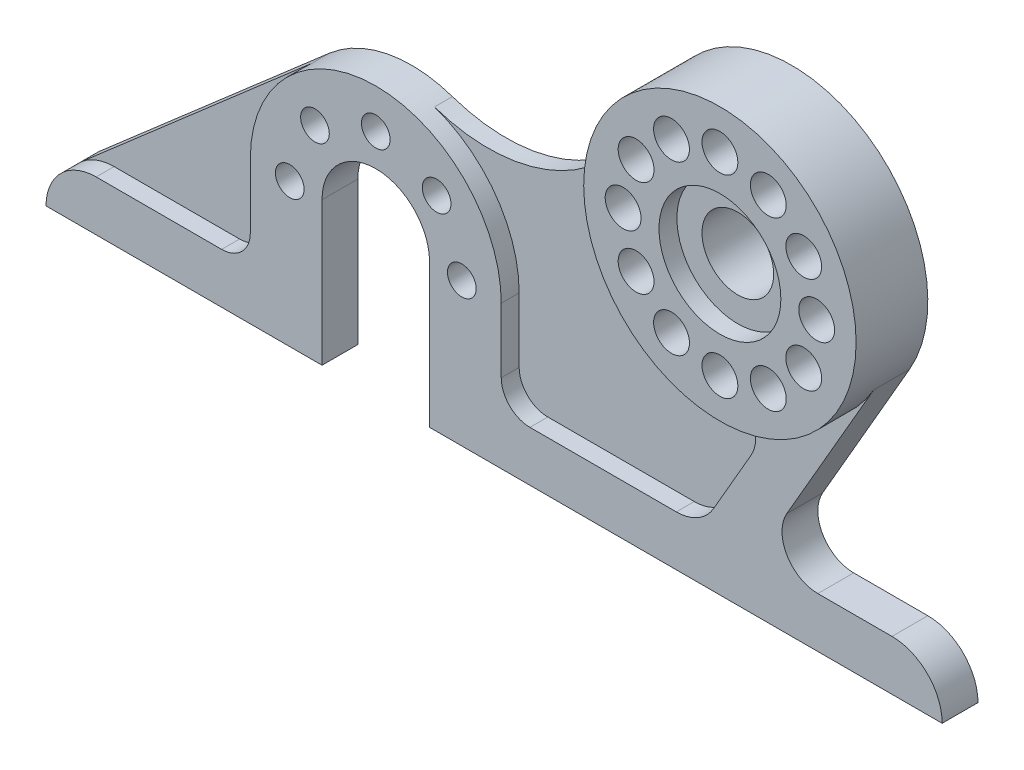
from build123d import *

# Parameters (mm, degrees)
SKETCH_1_R      = 4
EXTRUDE_1_DEPTH = 10
EXTRUDE_2_DEPTH = 5
SKETCH_1_4_R    = 17
SKETCH_1_4_R_2  = 10
EXTRUDE_3_DEPTH = 15
SKETCH_1_5_R    = 38
SKETCH_1_5_R_2  = 5
SKETCH_1_5_R_3  = 17
EXTRUDE_4_DEPTH = 20


with BuildPart() as part:
    # Эскиз1 → Бобышка-Вытянуть1 (new body)
    with BuildSketch(Plane.XY):
        with BuildLine():
            Line((-198, -90), (-121, -90))
            Line((-121, -90), (-121, -50))
            ThreePointArc((-121, -50), (-106, -35), (-91, -50))
            Line((-91, -50), (-91, -90))
            Line((-91, -90), (52, -90))
            ThreePointArc((52, -90), (47.899494937, -80.100505063), (38, -76))
            Line((38, -76), (17.320508076, -76))
            ThreePointArc((17.320508076, -76), (8.660254038, -71), (8.660254038, -61))
            Line((8.660254038, -61), (32.908965344, -19))
            ThreePointArc((32.908965344, -19), (15.44850963, -34.718057984), (-7.916666667, -37.166199549))
            ThreePointArc((-7.916666667, -37.166199549), (-0.863668952, -42.881381106), (-1.339745962, -51.946778377))
            Line((-1.339745962, -51.946778377), (-11.762778326, -70))
            ThreePointArc((-11.762778326, -70), (-16.155083171, -74.392304845), (-22.155083171, -76))
            Line((-22.155083171, -76), (-63, -76))
            ThreePointArc((-63, -76), (-68.656854249, -73.656854249), (-71, -68))
            Line((-71, -68), (-71, -50))
            ThreePointArc((-71, -50), (-106, -15), (-141, -50))
            Line((-141, -50), (-141, -68))
            ThreePointArc((-141, -68), (-143.343145751, -73.656854249), (-149, -76))
            Line((-149, -76), (-184, -76))
            ThreePointArc((-184, -76), (-193.899494937, -80.100505063), (-198, -90))
        make_face()
        with Locations((-130, -50)):
            Circle(SKETCH_1_R, mode=Mode.SUBTRACT)
        with Locations((-82, -50)):
            Circle(SKETCH_1_R, mode=Mode.SUBTRACT)
        with Locations((-122.970562748, -33.029437252)):
            Circle(SKETCH_1_R, mode=Mode.SUBTRACT)
        with Locations((-89.029437252, -33.029437252)):
            Circle(SKETCH_1_R, mode=Mode.SUBTRACT)
        with Locations((-106, -26)):
            Circle(SKETCH_1_R, mode=Mode.SUBTRACT)
    extrude(amount=EXTRUDE_1_DEPTH)

    # Эскиз1<3> → Бобышка-Вытянуть2 (add)
    with BuildSketch(Plane.XY):
        with BuildLine():
            Line((-128.966962921, -23.589422305), (-193.186785168, -79.435768922))
            ThreePointArc((-193.186785168, -79.435768922), (-188.904118927, -76.887043905), (-184, -76))
            Line((-184, -76), (-149, -76))
            ThreePointArc((-149, -76), (-143.343145751, -73.656854249), (-141, -68))
            Line((-141, -68), (-141, -50))
            ThreePointArc((-141, -50), (-137.849989813, -35.488688933), (-128.966962921, -23.589422305))
        make_face()
        with BuildLine():
            ThreePointArc((-36.043919772, 12.034776584), (-59.305035094, -14.640262917), (-94.625446436, -16.899856024))
            ThreePointArc((-94.625446436, -16.899856024), (-77.512201079, -29.666645318), (-71, -50))
            Line((-71, -50), (-71, -68))
            ThreePointArc((-71, -68), (-68.656854249, -73.656854249), (-63, -76))
            Line((-63, -76), (-22.155083171, -76))
            ThreePointArc((-22.155083171, -76), (-16.155083171, -74.392304845), (-11.762778326, -70))
            Line((-11.762778326, -70), (-1.339745962, -51.946778377))
            ThreePointArc((-1.339745962, -51.946778377), (-0.863668952, -42.881381106), (-7.916666667, -37.166199549))
            ThreePointArc((-7.916666667, -37.166199549), (-32.989654486, -18.859551874), (-36.043919772, 12.034776584))
        make_face()
    extrude(amount=EXTRUDE_2_DEPTH)



with BuildPart() as body_2:
    # Эскиз1<4> → Бобышка-Вытянуть3 (new body)
    with BuildSketch(Plane.XY):
        Circle(SKETCH_1_4_R)
        Circle(SKETCH_1_4_R_2, mode=Mode.SUBTRACT)
    extrude(amount=EXTRUDE_3_DEPTH)


with BuildPart() as part_1:
    add(part.part)

    add(body_2.part)  # Бобышка-Вытянуть4 merges body 2
    # Эскиз1<5> → Бобышка-Вытянуть4 (add)
    with BuildSketch(Plane.XY):
        with Locations(Location((0, 0, 0), (0, 0, 161.536247512))):
            Circle(SKETCH_1_5_R)
        with Locations((-13.5, 23.382685902)):
            Circle(SKETCH_1_5_R_2, mode=Mode.SUBTRACT)
        with Locations((-23.382685902, 13.5)):
            Circle(SKETCH_1_5_R_2, mode=Mode.SUBTRACT)
        with Locations((-27, 0)):
            Circle(SKETCH_1_5_R_2, mode=Mode.SUBTRACT)
        with Locations((-23.382685902, -13.5)):
            Circle(SKETCH_1_5_R_2, mode=Mode.SUBTRACT)
        with Locations((-13.5, -23.382685902)):
            Circle(SKETCH_1_5_R_2, mode=Mode.SUBTRACT)
        with Locations((0, -27)):
            Circle(SKETCH_1_5_R_2, mode=Mode.SUBTRACT)
        with Locations((13.5, -23.382685902)):
            Circle(SKETCH_1_5_R_2, mode=Mode.SUBTRACT)
        with Locations((23.382685902, -13.5)):
            Circle(SKETCH_1_5_R_2, mode=Mode.SUBTRACT)
        with Locations((27, 0)):
            Circle(SKETCH_1_5_R_2, mode=Mode.SUBTRACT)
        with Locations((23.382685902, 13.5)):
            Circle(SKETCH_1_5_R_2, mode=Mode.SUBTRACT)
        with Locations((13.5, 23.382685902)):
            Circle(SKETCH_1_5_R_2, mode=Mode.SUBTRACT)
        with Locations((0, 27)):
            Circle(SKETCH_1_5_R_2, mode=Mode.SUBTRACT)
        Circle(SKETCH_1_5_R_3, mode=Mode.SUBTRACT)
    extrude(amount=EXTRUDE_4_DEPTH)


solid = part_1.part
